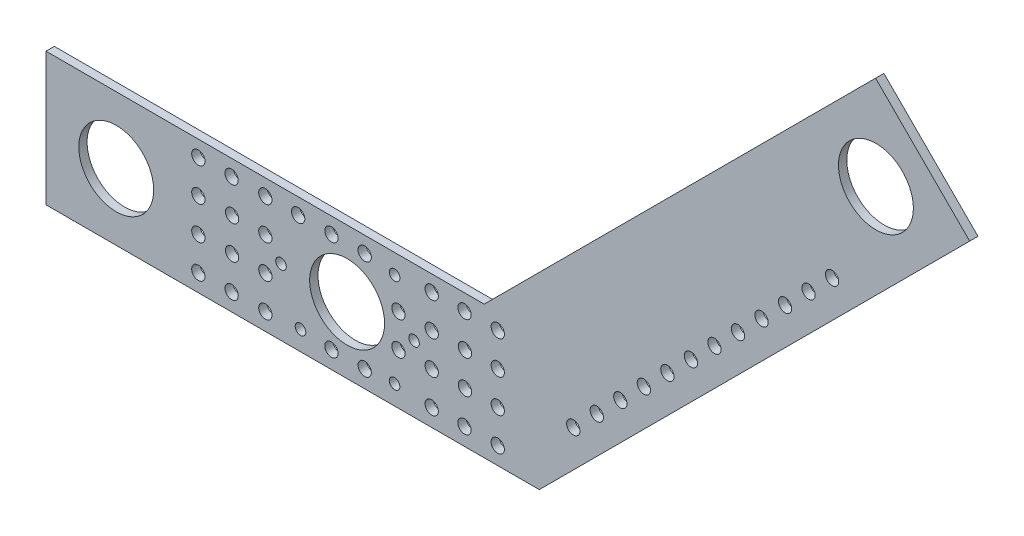
from build123d import *

# Parameters (mm, degrees)
SKETCH1_R           = 2.54
SKETCH1_R_2         = 2.0193
SKETCH1_R_3         = 14.3002
BOSS_EXTRUDE1_DEPTH = 3.175


with BuildPart() as part:
    # Sketch1 → Boss-Extrude1 (new body)
    with BuildSketch(Plane.XY):
        Polygon((-59.693768546, 4.271271353), (-59.693768546, -46.528728647), (128.614138554, -46.528728647), (292.911431822, 117.768564621), (256.990407338, 153.689589105), (107.572089586, 4.271271353), align=None)
        with Locations((24.040159799, -14.512116048)):
            Circle(SKETCH1_R, mode=Mode.SUBTRACT)
        with Locations((74.840159799, -14.512116048)):
            Circle(SKETCH1_R, mode=Mode.SUBTRACT)
        with Locations((87.540159799, -14.512116048)):
            Circle(SKETCH1_R, mode=Mode.SUBTRACT)
        with Locations((100.240159799, -14.512116048)):
            Circle(SKETCH1_R, mode=Mode.SUBTRACT)
        with Locations((100.240159799, -27.212116048)):
            Circle(SKETCH1_R, mode=Mode.SUBTRACT)
        with Locations((87.540159799, -27.212116048)):
            Circle(SKETCH1_R, mode=Mode.SUBTRACT)
        with Locations((74.840159799, -27.212116048)):
            Circle(SKETCH1_R, mode=Mode.SUBTRACT)
        with Locations((24.040159799, -27.212116048)):
            Circle(SKETCH1_R, mode=Mode.SUBTRACT)
        with Locations((11.340159799, -27.212116048)):
            Circle(SKETCH1_R, mode=Mode.SUBTRACT)
        with Locations((11.340159799, -14.512116048)):
            Circle(SKETCH1_R, mode=Mode.SUBTRACT)
        with Locations((11.158871814, -1.812116048)):
            Circle(SKETCH1_R, mode=Mode.SUBTRACT)
        with Locations((24.040159799, -1.812116048)):
            Circle(SKETCH1_R, mode=Mode.SUBTRACT)
        with Locations((36.558871814, -1.812116048)):
            Circle(SKETCH1_R, mode=Mode.SUBTRACT)
        with Locations((49.258871814, -1.812116048)):
            Circle(SKETCH1_R, mode=Mode.SUBTRACT)
        with Locations((61.958871814, -1.812116048)):
            Circle(SKETCH1_R, mode=Mode.SUBTRACT)
        with Locations((87.540159799, -1.812116048)):
            Circle(SKETCH1_R, mode=Mode.SUBTRACT)
        with Locations((100.058871814, -1.812116048)):
            Circle(SKETCH1_R, mode=Mode.SUBTRACT)
        with Locations((112.758871814, -1.812116048)):
            Circle(SKETCH1_R, mode=Mode.SUBTRACT)
        with Locations((112.758871814, -14.512116048)):
            Circle(SKETCH1_R, mode=Mode.SUBTRACT)
        with Locations((112.758871814, -27.212116048)):
            Circle(SKETCH1_R, mode=Mode.SUBTRACT)
        with Locations((112.758871814, -39.912116048)):
            Circle(SKETCH1_R, mode=Mode.SUBTRACT)
        with Locations((100.058871814, -39.912116048)):
            Circle(SKETCH1_R, mode=Mode.SUBTRACT)
        with Locations((87.540159799, -39.912116048)):
            Circle(SKETCH1_R, mode=Mode.SUBTRACT)
        with Locations((61.958871814, -39.912116048)):
            Circle(SKETCH1_R, mode=Mode.SUBTRACT)
        with Locations((49.258871814, -39.912116048)):
            Circle(SKETCH1_R, mode=Mode.SUBTRACT)
        with Locations((24.040159799, -39.912116048)):
            Circle(SKETCH1_R, mode=Mode.SUBTRACT)
        with Locations((11.158871814, -39.912116048)):
            Circle(SKETCH1_R, mode=Mode.SUBTRACT)
        with Locations((-1.541128186, -39.912116048)):
            Circle(SKETCH1_R, mode=Mode.SUBTRACT)
        with Locations((-1.541128186, -27.212116048)):
            Circle(SKETCH1_R, mode=Mode.SUBTRACT)
        with Locations((-1.541128186, -14.512116048)):
            Circle(SKETCH1_R, mode=Mode.SUBTRACT)
        with Locations((-1.541128186, -1.812116048)):
            Circle(SKETCH1_R, mode=Mode.SUBTRACT)
        with Locations((73.378301019, -3.178216405)):
            Circle(SKETCH1_R_2, mode=Mode.SUBTRACT)
        with Locations((80.817788776, -21.138728647)):
            Circle(SKETCH1_R_2, mode=Mode.SUBTRACT)
        with Locations((73.378301019, -39.099240889)):
            Circle(SKETCH1_R_2, mode=Mode.SUBTRACT)
        with Locations((37.457276534, -39.099240889)):
            Circle(SKETCH1_R_2, mode=Mode.SUBTRACT)
        with Locations((30.017788776, -21.138728647)):
            Circle(SKETCH1_R_2, mode=Mode.SUBTRACT)
        with Locations((55.2538213, -21.128728647)):
            Circle(SKETCH1_R_3, mode=Mode.SUBTRACT)
        with Locations((-32.8841787, -21.128728647)):
            Circle(SKETCH1_R_3, mode=Mode.SUBTRACT)
        with Locations((257.120708411, 117.898865694)):
            Circle(SKETCH1_R_3, mode=Mode.SUBTRACT)
        with Locations((141.58879302, -19.431025607)):
            Circle(SKETCH1_R, mode=Mode.SUBTRACT)
        with Locations((150.569049141, -10.450769486)):
            Circle(SKETCH1_R, mode=Mode.SUBTRACT)
        with Locations((159.549305262, -1.470513365)):
            Circle(SKETCH1_R, mode=Mode.SUBTRACT)
        with Locations((168.529561384, 7.509742756)):
            Circle(SKETCH1_R, mode=Mode.SUBTRACT)
        with Locations((177.509817505, 16.489998877)):
            Circle(SKETCH1_R, mode=Mode.SUBTRACT)
        with Locations((186.490073626, 25.470254998)):
            Circle(SKETCH1_R, mode=Mode.SUBTRACT)
        with Locations((195.470329747, 34.45051112)):
            Circle(SKETCH1_R, mode=Mode.SUBTRACT)
        with Locations((204.450585868, 43.430767241)):
            Circle(SKETCH1_R, mode=Mode.SUBTRACT)
        with Locations((213.430841989, 52.411023362)):
            Circle(SKETCH1_R, mode=Mode.SUBTRACT)
        with Locations((222.41109811, 61.391279483)):
            Circle(SKETCH1_R, mode=Mode.SUBTRACT)
        with Locations((231.391354231, 70.371535604)):
            Circle(SKETCH1_R, mode=Mode.SUBTRACT)
        with Locations((240.371610352, 79.351791725)):
            Circle(SKETCH1_R, mode=Mode.SUBTRACT)
    extrude(amount=BOSS_EXTRUDE1_DEPTH)


solid = part.part
